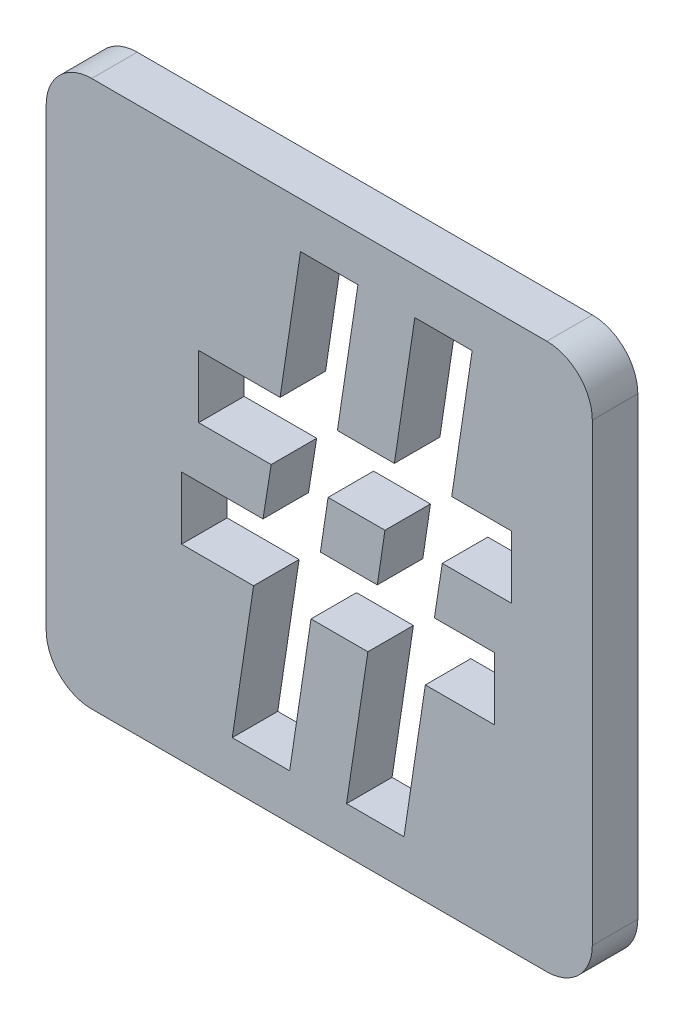
from build123d import *

# Parameters (mm, degrees)
BOSS_EXTRUDE1_DEPTH = 10
CUT_EXTRUDE11_DEPTH = 10


with BuildPart() as part:
    # Sketch1 → Boss-Extrude1 (new body)
    with BuildSketch(Plane.XY):
        with BuildLine():
            Line((-50, 60), (50, 60))
            ThreePointArc((50, 60), (57.071067812, 57.071067812), (60, 50))
            Line((60, 50), (60, -50))
            ThreePointArc((60, -50), (57.071067812, -57.071067812), (50, -60))
            Line((50, -60), (-50, -60))
            ThreePointArc((-50, -60), (-57.071067812, -57.071067812), (-60, -50))
            Line((-60, -50), (-60, 50))
            ThreePointArc((-60, 50), (-57.071067812, 57.071067812), (-50, 60))
        make_face()
    extrude(amount=BOSS_EXTRUDE1_DEPTH)

    # Sketch2 → Cut-Extrude11 (cut)
    with BuildSketch(Plane.XY.offset(10)):
        Polygon((38.5, -5), (38.5, -18.75), (23.3046875, -18.75), (18.6171875, -50), (6, -50), (10.6875, -18.75), (-1.8125, -18.75), (-6.5, -50), (-19.1171875, -50), (-14.4296875, -18.75), (-30.25, -18.75), (-30.25, -5), (-12.359375, -5), (-10.5625, 6.25), (-26.5, 6.25), (-26.5, 20), (-8.609375, 20), (-4.1171875, 50), (8.5, 50), (3.98828125, 20), (16.5078125, 20), (21, 50), (33.59765625, 50), (29.10546875, 20), (42.25, 20), (42.25, 6.25), (27.03515625, 6.25), (25.296875, -5), align=None)
        Polygon((14.4375, 6.25), (1.9375, 6.25), (0.2578125, -5), (12.7578125, -5), align=None, mode=Mode.SUBTRACT)
    extrude(amount=-CUT_EXTRUDE11_DEPTH, mode=Mode.SUBTRACT)


with BuildPart() as cut_extrude11_piece_1:
    # of the separate pieces the step leaves, piece 1, a body of its own (cut_extrude11_pieces)
    add(part.part.solids().sort_by_distance((-50, 60, 0))[0])


with BuildPart() as cut_extrude11_piece_2:
    # of the separate pieces the step leaves, piece 2, a body of its own (cut_extrude11_pieces)
    add(part.part.solids().sort_by_distance((14.4375, 6.25, 0))[0])


solid = Compound([cut_extrude11_piece_1.part, cut_extrude11_piece_2.part])
